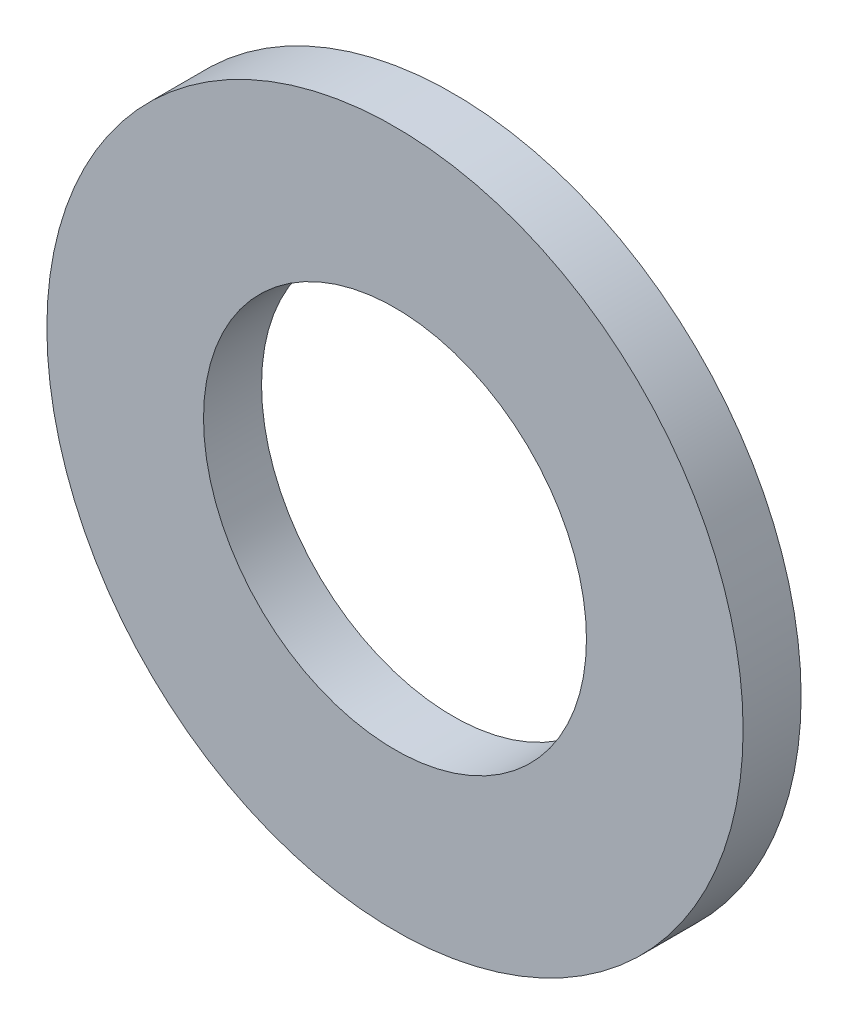
from build123d import *

# Parameters (mm, degrees)
SKETCH1_R           = 9.525
SKETCH1_R_2         = 5.23875
BOSS_EXTRUDE1_DEPTH = 0.79375


with BuildPart() as part:
    # Sketch1 → Boss-Extrude1 (new, symmetric)
    with BuildSketch(Plane.XY):
        Circle(SKETCH1_R)
        Circle(SKETCH1_R_2, mode=Mode.SUBTRACT)
    extrude(amount=BOSS_EXTRUDE1_DEPTH, both=True)


solid = part.part
